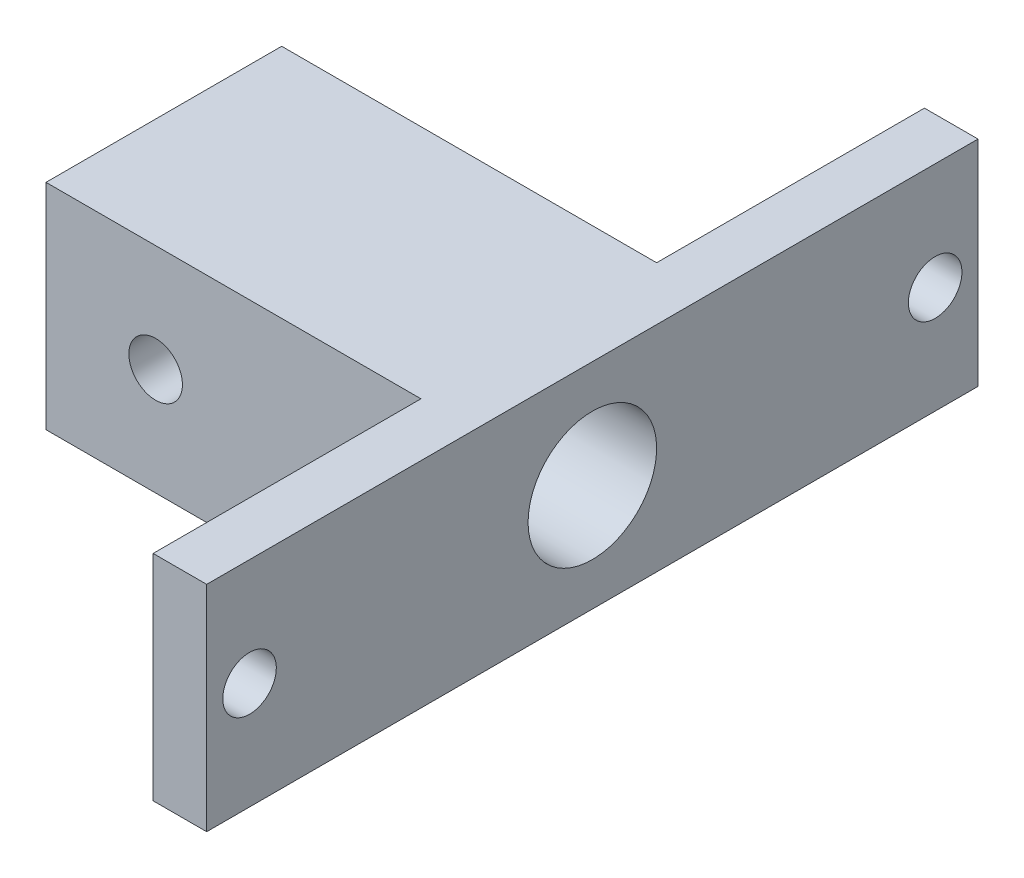
from build123d import *

# Parameters (mm, degrees)
SKETCH1_W           = 25.4
SKETCH1_H           = 12.7
BOSS_EXTRUDE1_DEPTH = 6.985
SKETCH3_W           = 3.175
SKETCH3_H           = 12.7
BOSS_EXTRUDE2_DEPTH = 15.875
SKETCH4_W           = 3.175
SKETCH4_H           = 12.7
BOSS_EXTRUDE3_DEPTH = 15.875
SKETCH5_R           = 1.5875
CUT_EXTRUDE2_DEPTH  = 33.50927137
SKETCH6_R           = 3.81
CUT_EXTRUDE3_DEPTH  = 35.757187746
SKETCH7_R           = 1.5875
CUT_EXTRUDE4_DEPTH  = 34.050514746


with BuildPart() as part:
    # Sketch1 → Boss-Extrude1 (new, symmetric)
    with BuildSketch(Plane.XY):
        Rectangle(SKETCH1_W, SKETCH1_H)
    extrude(amount=BOSS_EXTRUDE1_DEPTH, both=True)

    # Sketch3 → Boss-Extrude2 (add)
    with BuildSketch(Plane(origin=(0, 0, -6.985), x_dir=(-1, 0, 0), z_dir=(0, 0, -1))):
        with Locations((-11.1125, 0)):
            Rectangle(SKETCH3_W, SKETCH3_H)
    extrude(amount=BOSS_EXTRUDE2_DEPTH)

    # Sketch4 → Boss-Extrude3 (add)
    with BuildSketch(Plane.XY.offset(6.985)):
        with Locations((11.1125, 0)):
            Rectangle(SKETCH4_W, SKETCH4_H)
    extrude(amount=BOSS_EXTRUDE3_DEPTH)

    # Sketch5 → Cut-Extrude2 (cut, through all)
    with BuildSketch(Plane.ZY.offset(-9.525)):
        with Locations(Location((-20.32, 0, 0), (0, 0, 270))):
            Circle(SKETCH5_R)
        with Locations(Location((20.32, 0, 0), (0, 0, 270))):
            Circle(SKETCH5_R)
    extrude(amount=-CUT_EXTRUDE2_DEPTH, mode=Mode.SUBTRACT)

    # Sketch6 → Cut-Extrude3 (cut, through all)
    with BuildSketch(Plane.ZY.offset(12.7)):
        Circle(SKETCH6_R)
    extrude(amount=-CUT_EXTRUDE3_DEPTH, mode=Mode.SUBTRACT)

    # Sketch7 → Cut-Extrude4 (cut, through all)
    with BuildSketch(Plane.XY.offset(6.985)):
        with Locations((-6.20047096, 0)):
            Circle(SKETCH7_R)
    extrude(amount=-CUT_EXTRUDE4_DEPTH, mode=Mode.SUBTRACT)


solid = part.part
